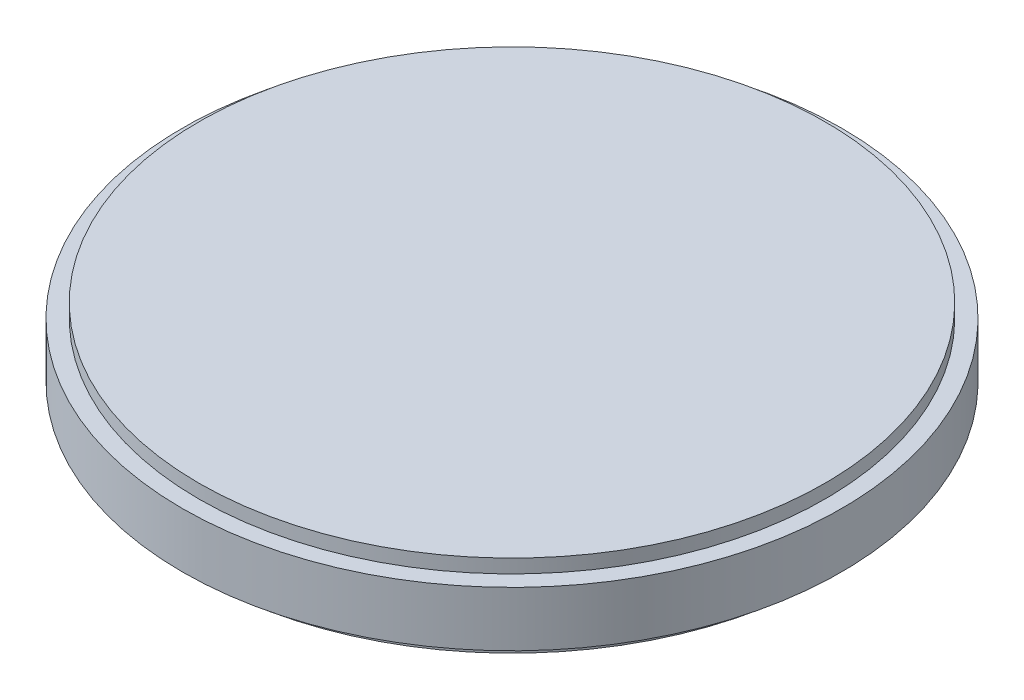
from build123d import *

# Parameters (mm, degrees)
SKETCH1_R      = 57
EXTRUDE4_DEPTH = 7.5
SKETCH_R       = 60
SKETCH_R_2     = 57
EXTRUDE5_DEPTH = 5


with BuildPart() as part:
    # Sketch1 → Extrude4 (new, symmetric)
    with BuildSketch(Plane(origin=(0, 0, 0), x_dir=(1, 0, 0), z_dir=(0, 1, 0))):
        Circle(SKETCH1_R)
    extrude(amount=EXTRUDE4_DEPTH, both=True)

    # Sketch → Extrude5 (add, symmetric)
    with BuildSketch(Plane(origin=(0, 0, 0), x_dir=(1, 0, 0), z_dir=(0, 1, 0))):
        Circle(SKETCH_R)
        Circle(SKETCH_R_2, mode=Mode.SUBTRACT)
    extrude(amount=EXTRUDE5_DEPTH, both=True)


solid = part.part
